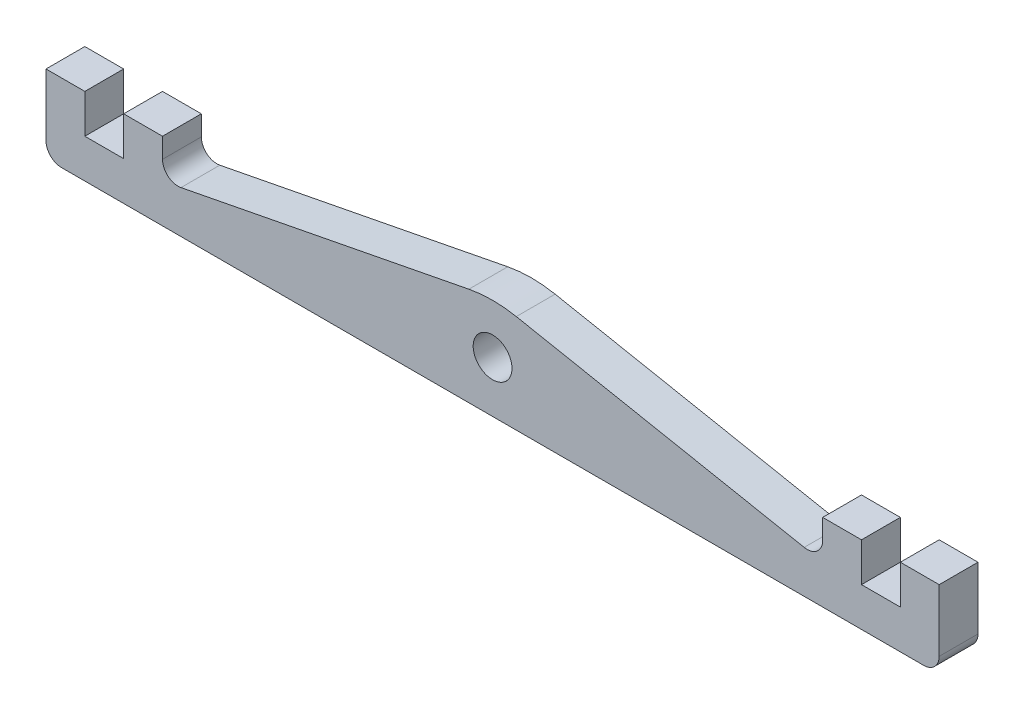
from build123d import *

# Parameters (mm, degrees)
SKETCH2_R      = 3.175
EXTRUDE1_DEPTH = 6.35


with BuildPart() as part:
    # Sketch2 → Extrude1 (new body)
    with BuildSketch(Plane.XY):
        with BuildLine():
            Line((-3.877238786, 18.628018312), (-50.950345152, 9.477933344))
            ThreePointArc((-50.950345152, 9.477933344), (-53.05063868, 10.011339949), (-53.975, 11.97126639))
            Line((-53.975, 11.97126639), (-53.975, 15.24))
            Line((-53.975, 15.24), (-60.325, 15.24))
            Line((-60.325, 15.24), (-60.325, 8.89))
            Line((-60.325, 8.89), (-66.675, 8.89))
            Line((-66.675, 8.89), (-66.675, 15.24))
            Line((-66.675, 15.24), (-73.025, 15.24))
            Line((-73.025, 15.24), (-73.025, 5.08))
            ThreePointArc((-73.025, 5.08), (-72.281051224, 3.283948776), (-70.485, 2.54))
            Line((-70.485, 2.54), (70.485, 2.54))
            ThreePointArc((70.485, 2.54), (72.281051224, 3.283948776), (73.025, 5.08))
            Line((73.025, 5.08), (73.025, 15.24))
            Line((73.025, 15.24), (66.675, 15.24))
            Line((66.675, 15.24), (66.675, 8.89))
            Line((66.675, 8.89), (60.325, 8.89))
            Line((60.325, 8.89), (60.325, 15.24))
            Line((60.325, 15.24), (53.975, 15.24))
            Line((53.975, 15.24), (53.975, 11.97126639))
            ThreePointArc((53.975, 11.97126639), (53.05063868, 10.011339949), (50.950345152, 9.477933344))
            Line((50.950345152, 9.477933344), (3.877238786, 18.628018312))
            ThreePointArc((3.877238786, 18.628018312), (0, 19.001353944), (-3.877238786, 18.628018312))
        make_face()
        with Locations((0, 10.922)):
            Circle(SKETCH2_R, mode=Mode.SUBTRACT)
    extrude(amount=EXTRUDE1_DEPTH)


solid = part.part
